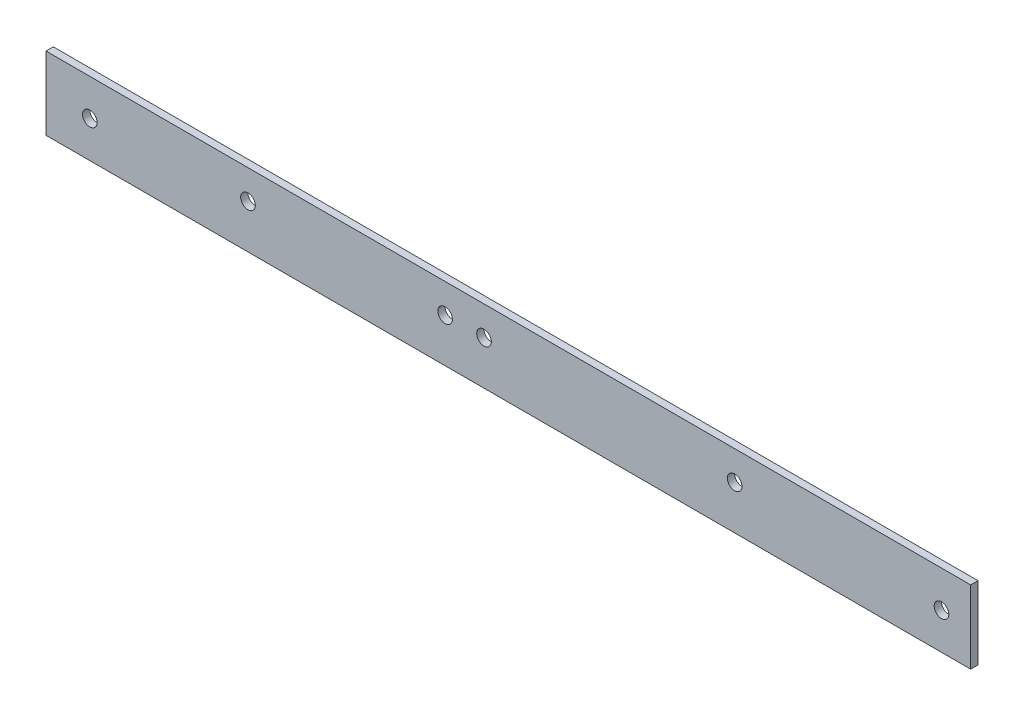
from build123d import *

# Parameters (mm, degrees)
ESQUISSE1_W      = 190
ESQUISSE1_H      = 15
ESQUISSE1_R      = 1.5
EXTRUSION1_DEPTH = 1.5


with BuildPart() as part:
    # Esquisse1 → Extrusion1 (new body)
    with BuildSketch(Plane.XY):
        with Locations((37.115471515, 15.453578947)):
            Rectangle(ESQUISSE1_W, ESQUISSE1_H)
        with Locations((-48.884528485, 15.453578947)):
            Circle(ESQUISSE1_R, mode=Mode.SUBTRACT)
        with Locations((126.115471515, 15.453578947)):
            Circle(ESQUISSE1_R, mode=Mode.SUBTRACT)
        with Locations((-16.384528485, 16.953578947)):
            Circle(ESQUISSE1_R, mode=Mode.SUBTRACT)
        with Locations((83.615471515, 16.953578947)):
            Circle(ESQUISSE1_R, mode=Mode.SUBTRACT)
        with Locations((32.115471515, 16.953578947)):
            Circle(ESQUISSE1_R, mode=Mode.SUBTRACT)
        with Locations((24.115471515, 16.953578947)):
            Circle(ESQUISSE1_R, mode=Mode.SUBTRACT)
    extrude(amount=EXTRUSION1_DEPTH)


solid = part.part
